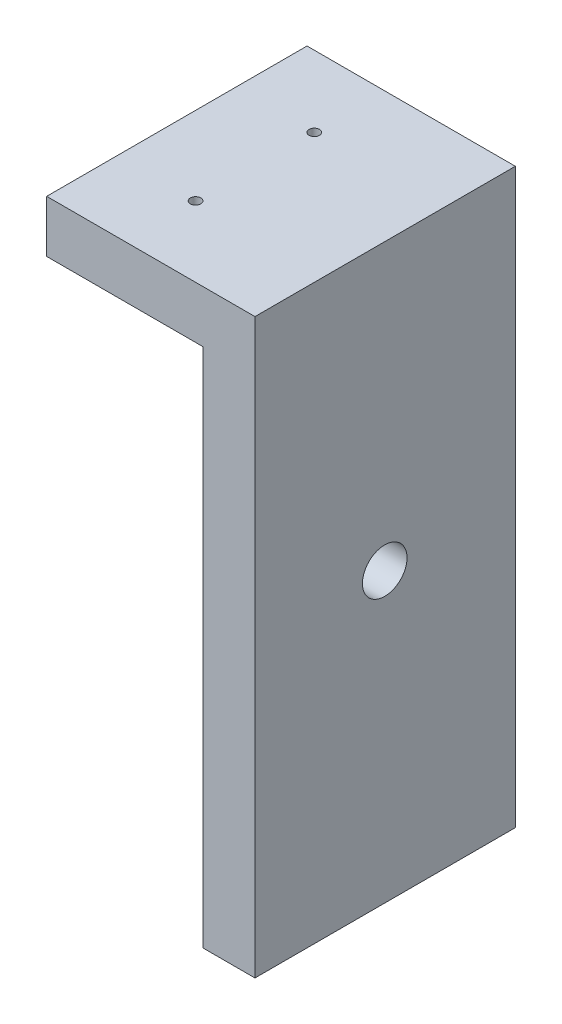
from build123d import *

# Parameters (mm, degrees)
SKETCH1_W           = 1
SKETCH1_H           = 10
BOSS_EXTRUDE1_DEPTH = 5
SKETCH2_W           = 4
SKETCH2_H           = 5
BOSS_EXTRUDE2_DEPTH = 1
SKETCH3_R           = 0.428245062
CUT_EXTRUDE1_DEPTH  = 1
SKETCH4_R           = 0.1
CUT_EXTRUDE2_DEPTH  = 1


with BuildPart() as part:
    # Sketch1 → Boss-Extrude1 (new body)
    with BuildSketch(Plane.XY):
        with Locations((0.5, 5)):
            Rectangle(SKETCH1_W, SKETCH1_H)
    extrude(amount=BOSS_EXTRUDE1_DEPTH)

    # Sketch2 → Boss-Extrude2 (add)
    with BuildSketch(Plane(origin=(0, 10, 0), x_dir=(1, 0, 0), z_dir=(0, 1, 0))):
        with Locations((-1, -2.5)):
            Rectangle(SKETCH2_W, SKETCH2_H)
    extrude(amount=BOSS_EXTRUDE2_DEPTH)

    # Sketch3 → Cut-Extrude1 (cut)
    with BuildSketch(Plane(origin=(1, 0, 0), x_dir=(0, 0, -1), z_dir=(1, 0, 0))):
        with Locations((-2.508031341, 5.528987799)):
            Circle(SKETCH3_R)
    extrude(amount=-CUT_EXTRUDE1_DEPTH, mode=Mode.SUBTRACT)

    # Sketch4 → Cut-Extrude2 (cut)
    with BuildSketch(Plane(origin=(0, 10, 0), x_dir=(-1, 0, 0), z_dir=(0, -1, 0))):
        with Locations(Location((1.494110206, -1.366840593, 0), (0, 0, 90))):
            Circle(SKETCH4_R)
        with Locations(Location((1.494110206, -3.646335679, 0), (0, 0, 90))):
            Circle(SKETCH4_R)
    extrude(amount=-CUT_EXTRUDE2_DEPTH, mode=Mode.SUBTRACT)


solid = part.part
